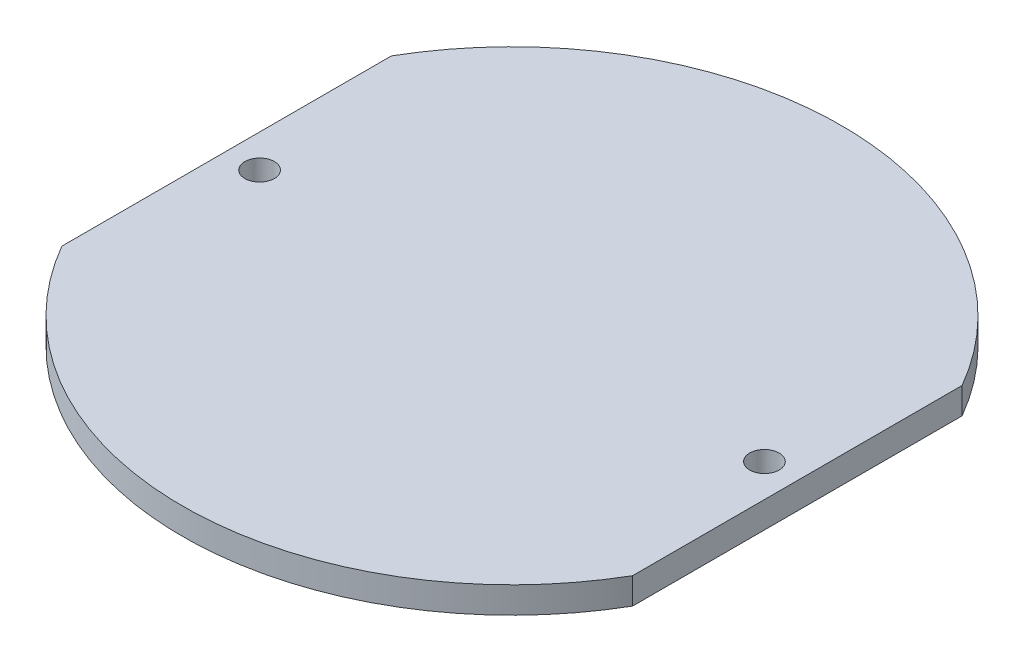
from build123d import *

# Parameters (mm, degrees)
SKETCH1_R  = 1.4224
BASE_DEPTH = 2.54


with BuildPart() as part:
    # Sketch1 → Base (new body)
    with BuildSketch(Plane(origin=(0, 0, 0), x_dir=(1, 0, 0), z_dir=(0, 1, 0))):
        with BuildLine():
            Line((-27.49630657, 15.875), (-27.49630657, -15.875))
            ThreePointArc((-27.49630657, -15.875), (0, -31.75), (27.49630657, -15.875))
            Line((27.49630657, -15.875), (27.49630657, 15.875))
            ThreePointArc((27.49630657, 15.875), (0, 31.75), (-27.49630657, 15.875))
        make_face()
        with Locations(Location((-24.32130657, 0, 0), (0, 0, 270))):
            Circle(SKETCH1_R, mode=Mode.SUBTRACT)
        with Locations(Location((24.32130657, 0, 0), (0, 0, 90))):
            Circle(SKETCH1_R, mode=Mode.SUBTRACT)
    extrude(amount=BASE_DEPTH)


solid = part.part
